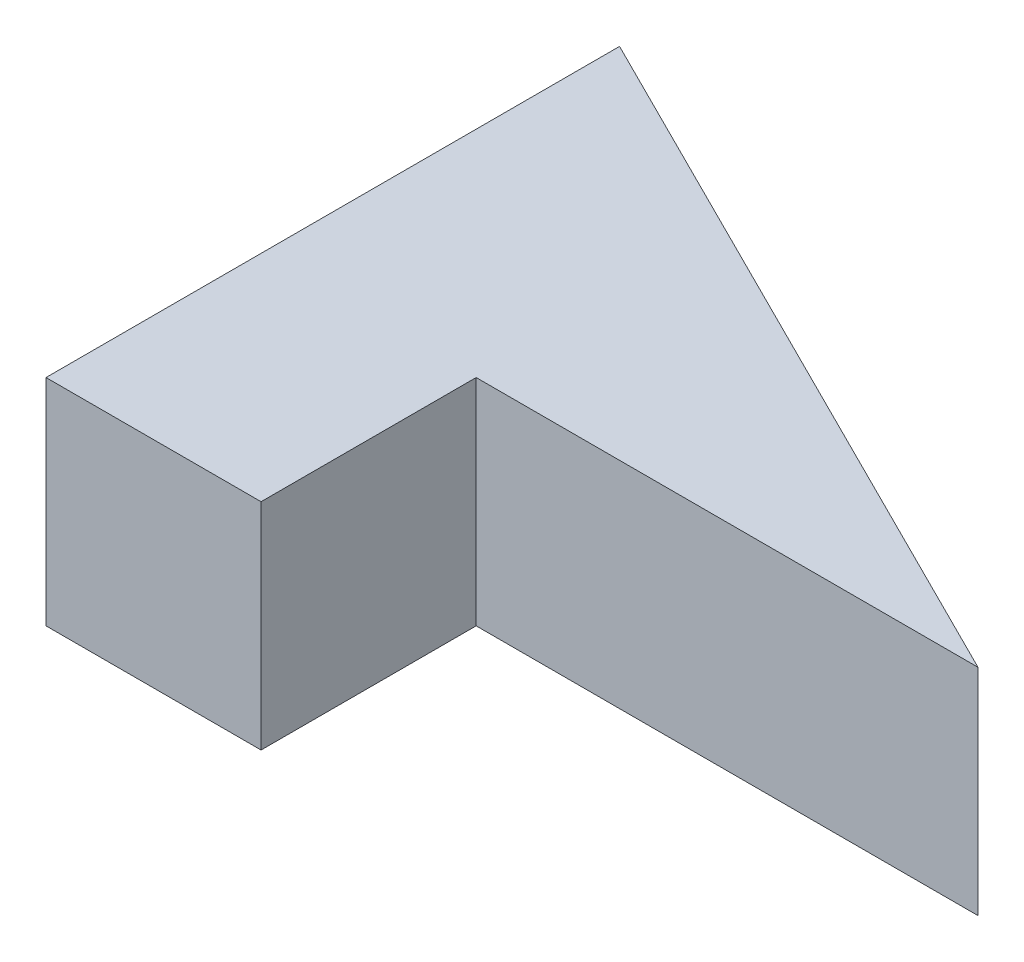
from build123d import *

# Parameters (mm, degrees)
BOSS_EXTRUDE1_DEPTH = 3


with BuildPart() as part:
    # Sketch1 → Boss-Extrude1 (new body)
    with BuildSketch(Plane(origin=(0, 0, 0), x_dir=(1, 0, 0), z_dir=(0, 1, 0))):
        Polygon((3, 0), (10, 0), (0, 5), (0, 0), (0, -3), (3, -3), align=None)
    extrude(amount=BOSS_EXTRUDE1_DEPTH)


solid = part.part
